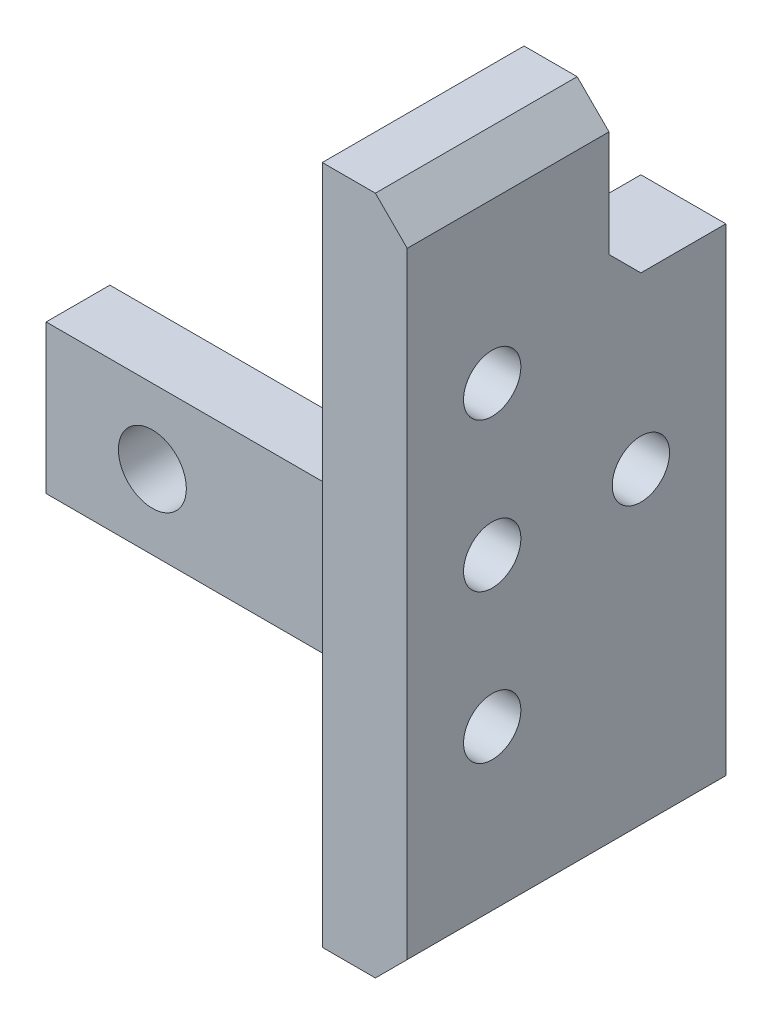
from build123d import *

# Parameters (mm, degrees)
SZKIC1_W                    = 25
SZKIC1_H                    = 7
DODANIE_WYCI_GNI_CIE1_DEPTH = 3
SZKIC2_W                    = 15
SZKIC2_H                    = 32
DODANIE_WYCI_GNI_CIE2_DEPTH = 4
SZKIC3_R                    = 1.6
WYTNIJ_WYCI_GNI_CIE1_DEPTH  = 43.393985422
WYTNIJ_WYCI_GNI_CIE2_REACH  = 45.339
SZKIC4_W                    = 5.5
SZKIC4_H                    = 8
WYTNIJ_WYCI_GNI_CIE3_REACH  = 45.339
SZKIC5_R                    = 1.35
SFAZOWANIE1_SIZE            = 1.5
SFAZOWANIE2_SIZE            = 2


with BuildPart() as part:
    # Szkic1 → Dodanie-wyciągnięcie1 (new body)
    with BuildSketch(Plane.XY):
        with Locations((12.5, 0)):
            Rectangle(SZKIC1_W, SZKIC1_H)
    extrude(amount=DODANIE_WYCI_GNI_CIE1_DEPTH)

    # Szkic2 → Dodanie-wyciągnięcie2 (add)
    with BuildSketch(Plane(origin=(25, 0, 0), x_dir=(0, 0, -1), z_dir=(1, 0, 0))):
        with Locations((-7.5, 12.5)):
            Rectangle(SZKIC2_W, SZKIC2_H)
    extrude(amount=DODANIE_WYCI_GNI_CIE2_DEPTH)

    # Szkic3 → Wytnij-wyciągnięcie1 (cut, through all)
    with BuildSketch(Plane.XY.offset(3)):
        with Locations((5, 0)):
            Circle(SZKIC3_R)
        with Locations((20, 0)):
            Circle(SZKIC3_R)
    extrude(amount=-WYTNIJ_WYCI_GNI_CIE1_DEPTH, mode=Mode.SUBTRACT)

    # Szkic4 → Wytnij-wyciągnięcie2 (cut, up to next)
    with BuildSketch(Plane(origin=(29, 0, 0), x_dir=(0, 0, -1), z_dir=(1, 0, 0)), mode=Mode.PRIVATE) as wytnij_wyci_gni_cie2_sk1:
        with Locations((-2.75, 24.5)):
            Rectangle(SZKIC4_W, SZKIC4_H)
    wytnij_wyci_gni_cie2_tool1 = extrude(wytnij_wyci_gni_cie2_sk1.sketch, amount=-WYTNIJ_WYCI_GNI_CIE2_REACH, mode=Mode.PRIVATE) & part.part
    add(wytnij_wyci_gni_cie2_tool1.solids().sort_by_distance((29, 24.5, 2.75))[0], mode=Mode.SUBTRACT)

    # Szkic5 → Wytnij-wyciągnięcie3 (cut, up to next)
    with BuildSketch(Plane(origin=(29, 0, 0), x_dir=(0, 0, -1), z_dir=(1, 0, 0)), mode=Mode.PRIVATE) as wytnij_wyci_gni_cie3_sk1:
        with Locations((-11, 12.5)):
            Circle(SZKIC5_R)
    wytnij_wyci_gni_cie3_tool1 = extrude(wytnij_wyci_gni_cie3_sk1.sketch, amount=-WYTNIJ_WYCI_GNI_CIE3_REACH, mode=Mode.PRIVATE) & part.part
    # Szkic5 → Wytnij-wyciągnięcie3 (cut, up to next)
    with BuildSketch(Plane(origin=(29, 0, 0), x_dir=(0, 0, -1), z_dir=(1, 0, 0)), mode=Mode.PRIVATE) as wytnij_wyci_gni_cie3_sk2:
        with Locations((-4, 12.5)):
            Circle(SZKIC5_R)
    wytnij_wyci_gni_cie3_tool2 = extrude(wytnij_wyci_gni_cie3_sk2.sketch, amount=-WYTNIJ_WYCI_GNI_CIE3_REACH, mode=Mode.PRIVATE) & part.part
    # Szkic5 → Wytnij-wyciągnięcie3 (cut, up to next)
    with BuildSketch(Plane(origin=(29, 0, 0), x_dir=(0, 0, -1), z_dir=(1, 0, 0)), mode=Mode.PRIVATE) as wytnij_wyci_gni_cie3_sk3:
        with Locations((-11, 5.5)):
            Circle(SZKIC5_R)
    wytnij_wyci_gni_cie3_tool3 = extrude(wytnij_wyci_gni_cie3_sk3.sketch, amount=-WYTNIJ_WYCI_GNI_CIE3_REACH, mode=Mode.PRIVATE) & part.part
    # Szkic5 → Wytnij-wyciągnięcie3 (cut, up to next)
    with BuildSketch(Plane(origin=(29, 0, 0), x_dir=(0, 0, -1), z_dir=(1, 0, 0)), mode=Mode.PRIVATE) as wytnij_wyci_gni_cie3_sk4:
        with Locations((-11, 19.5)):
            Circle(SZKIC5_R)
    wytnij_wyci_gni_cie3_tool4 = extrude(wytnij_wyci_gni_cie3_sk4.sketch, amount=-WYTNIJ_WYCI_GNI_CIE3_REACH, mode=Mode.PRIVATE) & part.part
    add(wytnij_wyci_gni_cie3_tool1.solids().sort_by_distance((29, 12.5, 11))[0], mode=Mode.SUBTRACT)
    add(wytnij_wyci_gni_cie3_tool2.solids().sort_by_distance((29, 12.5, 4))[0], mode=Mode.SUBTRACT)
    add(wytnij_wyci_gni_cie3_tool3.solids().sort_by_distance((29, 5.5, 11))[0], mode=Mode.SUBTRACT)
    add(wytnij_wyci_gni_cie3_tool4.solids().sort_by_distance((29, 19.5, 11))[0], mode=Mode.SUBTRACT)

    # Sfazowanie1
    sfazowanie1_edges = [part.edges().sort_by_distance(p)[0] for p in [
        (29, -3.5, 7.5),
        (29, 28.5, 10.25),
        (27, 20.5, 5.5),
    ]]
    chamfer(sfazowanie1_edges, length=SFAZOWANIE1_SIZE)

    # Sfazowanie2
    sfazowanie2_edges = [part.edges().sort_by_distance(p)[0] for p in [
        (25, 0, 3),
    ]]
    chamfer(sfazowanie2_edges, length=SFAZOWANIE2_SIZE)


solid = part.part
